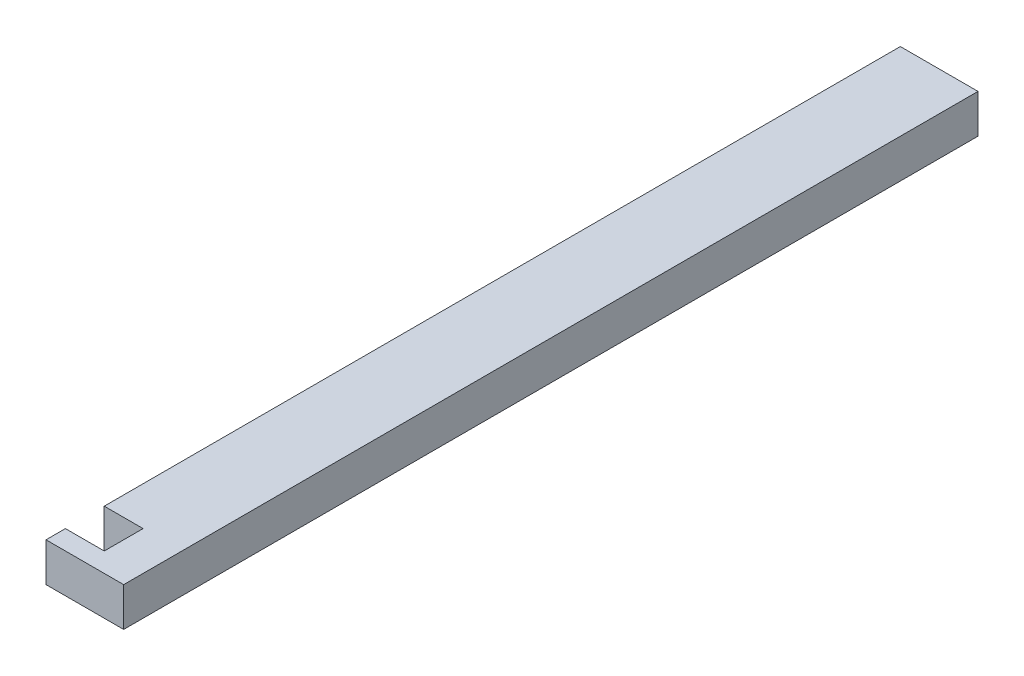
from build123d import *

# Parameters (mm, degrees)
SKETCH1_W           = 101.6
SKETCH1_H           = 50.8
BOSS_EXTRUDE1_DEPTH = 1219.2
SKETCH2_W           = 101.6
SKETCH2_H           = 50.8
CUT_EXTRUDE1_DEPTH  = 101.6
SKETCH3_W           = 50.8
SKETCH3_H           = 50.8
CUT_EXTRUDE2_DEPTH  = 50.8


with BuildPart() as part:
    # Sketch1 → Boss-Extrude1 (new body)
    with BuildSketch(Plane.XY):
        Rectangle(SKETCH1_W, SKETCH1_H)
    extrude(amount=BOSS_EXTRUDE1_DEPTH)

    # Sketch2 → Cut-Extrude1 (cut)
    with BuildSketch(Plane.XY.offset(1219.2)):
        Rectangle(SKETCH2_W, SKETCH2_H)
    extrude(amount=-CUT_EXTRUDE1_DEPTH, mode=Mode.SUBTRACT)

    # Sketch3 → Cut-Extrude2 (cut)
    with BuildSketch(Plane.ZY.offset(50.8)):
        with Locations((1066.8, 0)):
            Rectangle(SKETCH3_W, SKETCH3_H)
    extrude(amount=-CUT_EXTRUDE2_DEPTH, mode=Mode.SUBTRACT)


solid = part.part
